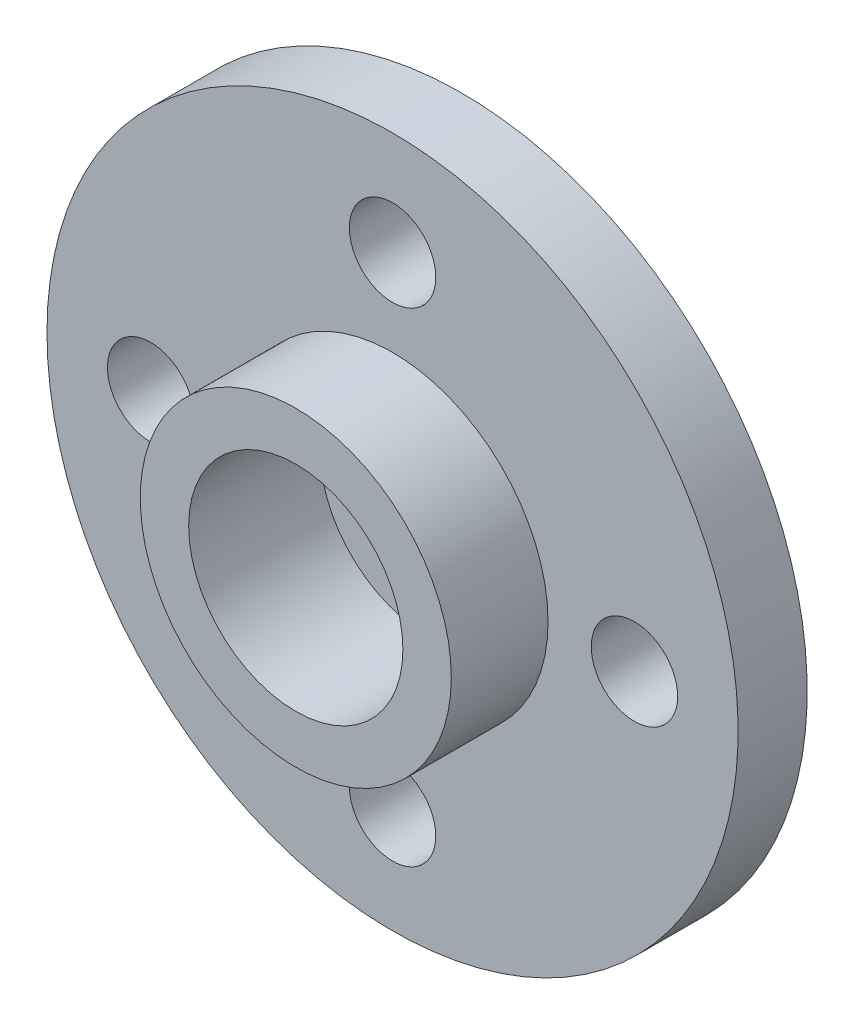
from build123d import *

# Parameters (mm, degrees)
SKETCH_1_W                   = 10
SKETCH_1_H                   = 2
SKETCH_2_R                   = 4.5
EXTRUDE_1_DEPTH              = 2.8
HOLE_WIZARD_2_5_2_5_1_D      = 2.5
HOLE_WIZARD_M3_1_D           = 3.2
HOLE_WIZARD_M3_1_CBORE_D     = 6.2
HOLE_WIZARD_M3_1_CBORE_DEPTH = 3.8


with BuildPart() as part:
    # 草图1 → 旋转1 (revolve)
    with BuildSketch(Plane.XZ.offset(19.899998127), mode=Mode.PRIVATE) as revolve_1_sk:
        with Locations((-34.10264652, -35.124)):
            Rectangle(SKETCH_1_W, SKETCH_1_H)
    revolve(revolve_1_sk.sketch.rotate(Axis((-39.10264652, -19.899998127, -34.124), (0, 0, -1)), 180), axis=Axis((-39.10264652, -19.899998127, -34.124), (0, 0, -1)))

    # 草图2 → 凸台-拉伸1 (add)
    with BuildSketch(Plane.XY.offset(-34.124)):
        with Locations((-39.10264652, -19.899998127)):
            Circle(SKETCH_2_R)
    extrude(amount=EXTRUDE_1_DEPTH)

    # Ø2.5 (2.5) 直径孔1 (through all)
    with Locations(Plane.XY.offset(-34.124)):
        with Locations((-39.10264652, -26.9), (-32.102644647, -19.899998127), (-39.10264652, -12.899996254), (-46.102648393, -19.899998127)):
            Hole(HOLE_WIZARD_2_5_2_5_1_D / 2)

    # M3 六角头机械螺钉的柱形沉头孔1 (through all)
    with Locations(Plane.XY.offset(-31.324)):
        with Locations((-39.10264652, -19.899998127)):
            CounterBoreHole(HOLE_WIZARD_M3_1_D / 2, HOLE_WIZARD_M3_1_CBORE_D / 2, HOLE_WIZARD_M3_1_CBORE_DEPTH)


solid = part.part
